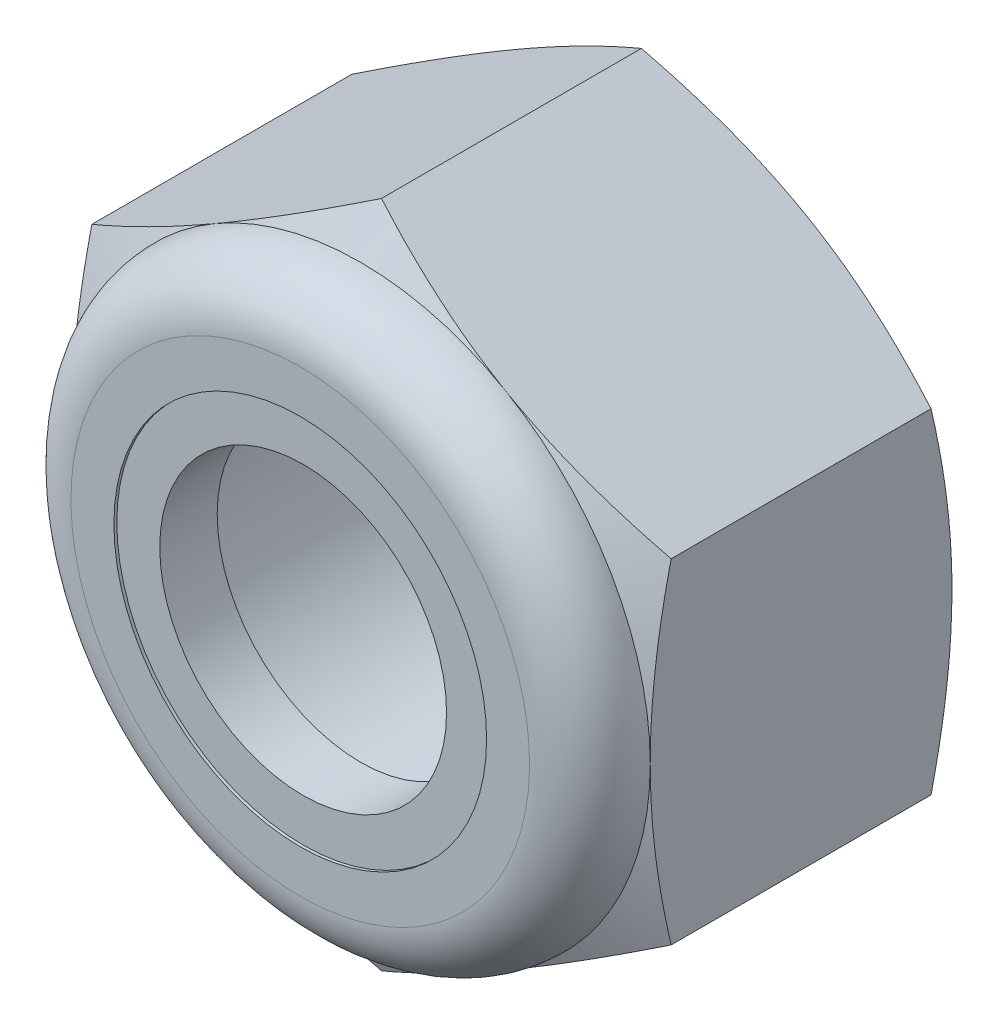
from build123d import *

# Parameters (mm, degrees)
SKETCH3_R           = 2.5
BOSS_EXTRUDE1_DEPTH = 2.5


with BuildPart() as part:
    # Sketch3 → Boss-Extrude1 (new, symmetric)
    with BuildSketch(Plane.XY):
        Polygon((0, -4.618802154), (4, -2.309401077), (4, 2.309401077), (0, 4.618802154), (-4, 2.309401077), (-4, -2.309401077), align=None)
        Circle(SKETCH3_R, mode=Mode.SUBTRACT)
    extrude(amount=BOSS_EXTRUDE1_DEPTH, both=True)

    # Sketch4 → Cut-Revolve1 (revolve, cut)
    with BuildSketch(Plane(origin=(0, 0, 0), x_dir=(0, 0, -1), z_dir=(1, 0, 0))):
        with BuildLine():
            Line((3.77, 5.888802154), (-3.77, 5.888802154))
            Line((-3.77, 5.888802154), (-3.77, 3.166666667))
            Line((-3.77, 3.166666667), (-2.5, 3.166666667))
            ThreePointArc((-2.5, 3.166666667), (-2.255922318, 3.755922318), (-1.666666667, 4))
            Line((-1.666666667, 4), (-1.378114484, 4.618802154))
            Line((-1.378114484, 4.618802154), (2.211447817, 4.618802154))
            Line((2.211447817, 4.618802154), (2.5, 4))
            Line((2.5, 4), (2.5, 0))
            Line((2.5, 0), (3.77, 0))
            Line((3.77, 0), (3.77, 5.888802154))
        make_face()
        with BuildLine():
            Line((-3.77, 2.573525712), (-3.77, 0))
            Line((-3.77, 0), (-1.666666667, 0))
            Line((-1.666666667, 0), (-1.666666667, 3.96))
            ThreePointArc((-1.666666667, 3.96), (-2.227638046, 3.727638046), (-2.46, 3.166666667))
            Line((-2.46, 3.166666667), (-2.46, 2.573525712))
            Line((-2.46, 2.573525712), (-3.77, 2.573525712))
        make_face()
    revolve(axis=Axis((0, 0, -2.5), (0, 0, 1)), mode=Mode.SUBTRACT)


with BuildPart() as body_2:
    # Sketch5 → Revolve1 (revolve)
    with BuildSketch(Plane(origin=(0, 0, 0), x_dir=(0, 0, -1), z_dir=(1, 0, 0))):
        with BuildLine():
            Line((-2.46, 3.166666667), (-2.46, 1.980384758))
            Line((-2.46, 1.980384758), (-1.666666667, 1.980384758))
            Line((-1.666666667, 1.980384758), (-1.666666667, 3.96))
            ThreePointArc((-1.666666667, 3.96), (-2.227638046, 3.727638046), (-2.46, 3.166666667))
        make_face()
    revolve(axis=Axis((0, 0, -2.5), (0, 0, 1)))


solid = Compound([part.part, body_2.part])
